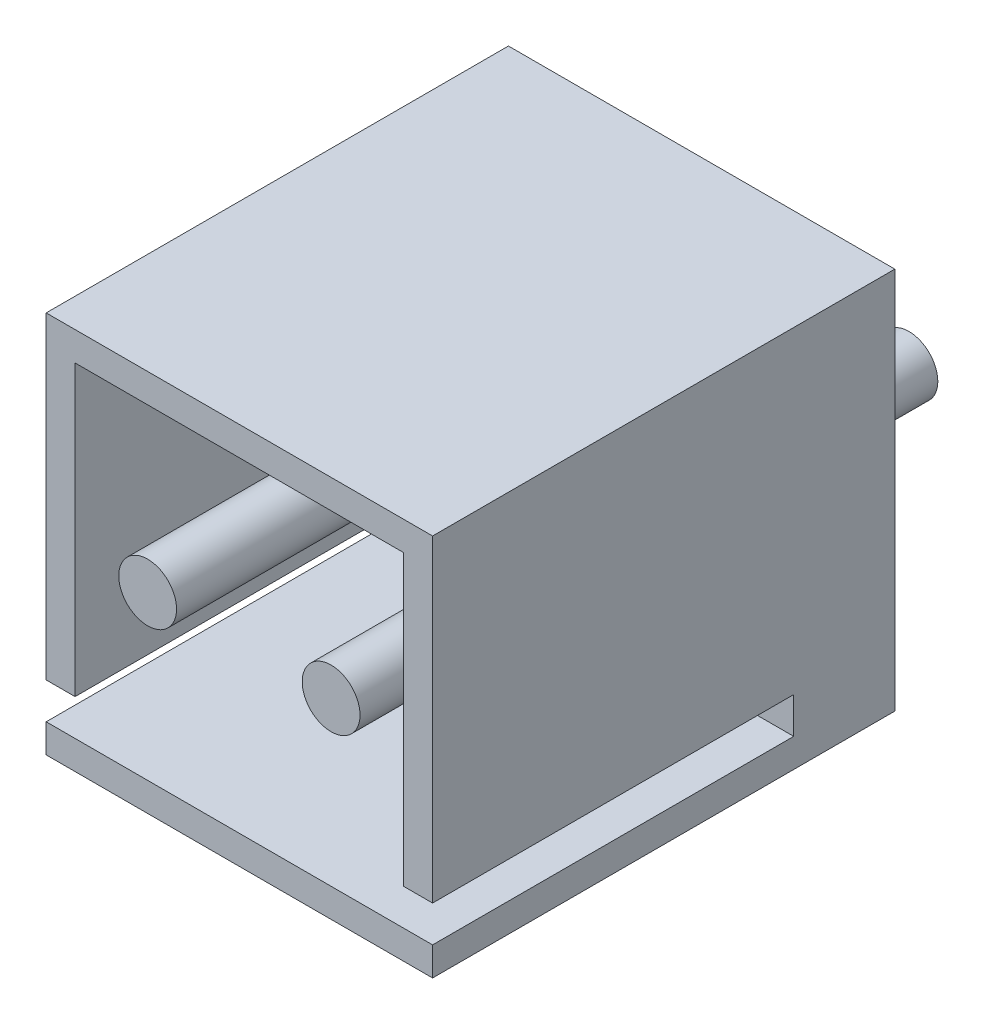
from build123d import *

# Parameters (mm, degrees)
SKETCH_1_W          = 5.35
SKETCH_1_H          = 5.3
EXTRUDE_1_DEPTH     = 6.4
SKETCH_2_W          = 4.55
SKETCH_2_H          = 4.5
SKETCH_2_R          = 0.4
CUT_EXTRUDE_1_DEPTH = 5
SKETCH_3_W          = 12.899416502
SKETCH_3_H          = 0.501475964
CUT_EXTRUDE_2_DEPTH = 5
SKETCH_4_R          = 0.4
EXTRUDE_2_DEPTH     = 8


with BuildPart() as part:
    # Эскиз1 → Вытянуть1 (new body)
    with BuildSketch(Plane.XY):
        Rectangle(SKETCH_1_W, SKETCH_1_H)
    extrude(amount=EXTRUDE_1_DEPTH)

    # Эскиз2 → Вырез-Вытянуть1 (cut)
    with BuildSketch(Plane.XY.offset(6.4)):
        Rectangle(SKETCH_2_W, SKETCH_2_H)
        with Locations((-1.27, 0)):
            Circle(SKETCH_2_R, mode=Mode.SUBTRACT)
        with Locations((1.27, 0)):
            Circle(SKETCH_2_R, mode=Mode.SUBTRACT)
    extrude(amount=-CUT_EXTRUDE_1_DEPTH, mode=Mode.SUBTRACT)

    # Эскиз3 → Вырез-Вытянуть2 (cut)
    with BuildSketch(Plane.XY.offset(6.4)):
        with Locations((-0.066925705, -2.002104797)):
            Rectangle(SKETCH_3_W, SKETCH_3_H)
    extrude(amount=-CUT_EXTRUDE_2_DEPTH, mode=Mode.SUBTRACT)

    # Эскиз4 → Вытянуть2 (add)
    with BuildSketch(Plane.XY.offset(6.4)):
        with Locations((-1.27, 0)):
            Circle(SKETCH_4_R)
        with Locations((1.27, 0)):
            Circle(SKETCH_4_R)
    extrude(amount=-EXTRUDE_2_DEPTH)


solid = part.part
